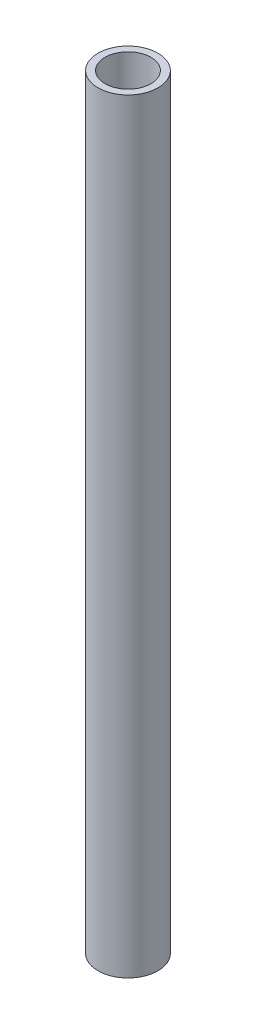
from build123d import *

# Parameters (mm, degrees)
SKETCH1_R    = 0.6477
SKETCH1_R_2  = 0.4953
NEEDLE_DEPTH = 16.51


with BuildPart() as part:
    # Sketch1 → Needle (new body)
    with BuildSketch(Plane(origin=(0, 0, 0), x_dir=(1, 0, 0), z_dir=(0, 1, 0))):
        with Locations(Location((0, 0, 0), (0, 0, 270))):
            Circle(SKETCH1_R)
        with Locations(Location((0, 0, 0), (0, 0, 270))):
            Circle(SKETCH1_R_2, mode=Mode.SUBTRACT)
    extrude(amount=-NEEDLE_DEPTH)


solid = part.part
